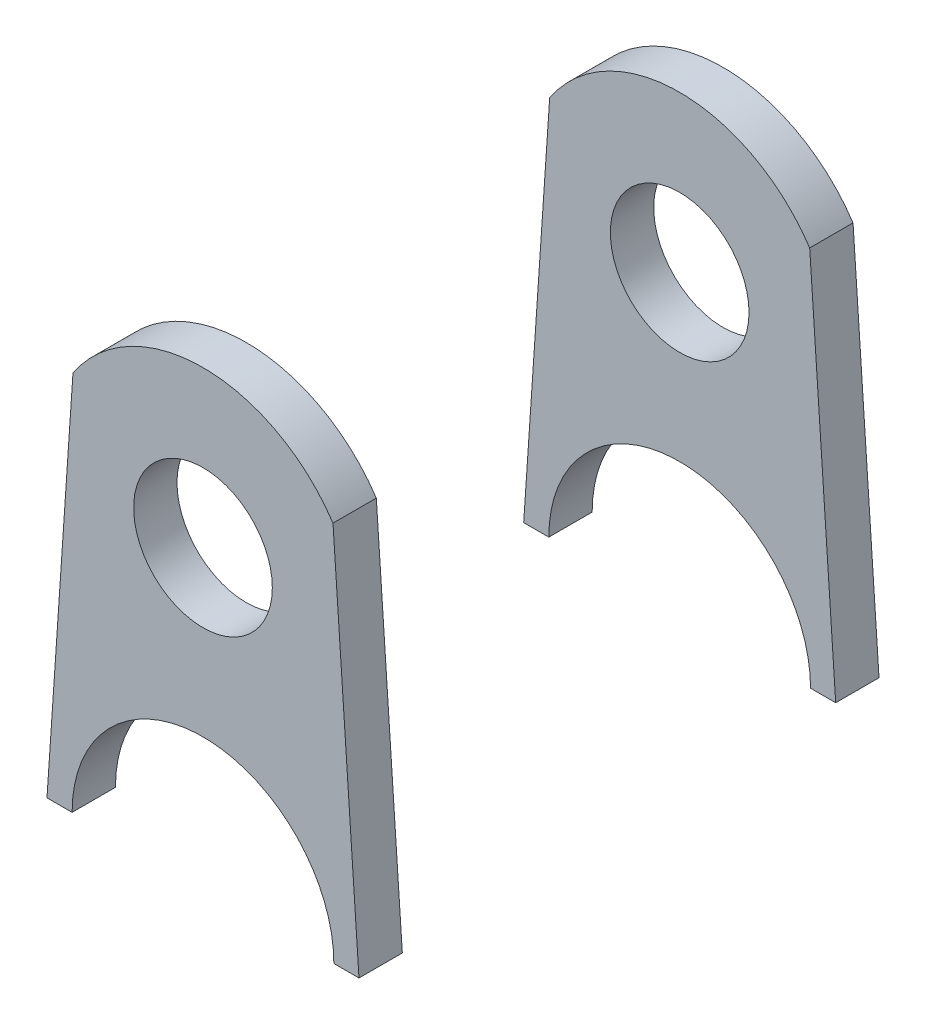
from build123d import *

# Parameters (mm, degrees)
BOSS_EXTRUDE2_DEPTH      = 15
BOSS_EXTRUDE2_DEPTH_BACK = 15
SKETCH1_R                = 7.55
SKETCH1_R_2              = 4
CUT_EXTRUDE4_DEPTH       = 35.252737117
CUT_EXTRUDE4_DEPTH_BACK  = 35.252737117
SKETCH5_W                = 18
SKETCH5_H                = 25
CUT_EXTRUDE5_DEPTH       = 43.991278185
CUT_EXTRUDE5_DEPTH_BACK  = 43.991278185


with BuildPart() as part:
    # Sketch1 → Boss-Extrude2 (new, two sides: drawn at the far end of the back side and taken through both)
    with BuildSketch(Plane.XY.offset(-BOSS_EXTRUDE2_DEPTH_BACK)):
        with BuildLine():
            Line((-1.416520296, 1.222974164), (-1.5, 0))
            ThreePointArc((-1.5, 0), (7.5, -9), (16.5, 0))
            Line((16.5, 0), (16.416520296, 1.222974164))
            Line((16.416520296, 1.222974164), (15, 21.974937186))
            ThreePointArc((15, 21.974937186), (7.5, 26), (0, 21.974937186))
            Line((0, 21.974937186), (-1.416520296, 1.222974164))
        make_face()
        with Locations((7.5, 0)):
            Circle(SKETCH1_R, mode=Mode.SUBTRACT)
        with Locations((7.5, 17)):
            Circle(SKETCH1_R_2, mode=Mode.SUBTRACT)
    extrude(amount=BOSS_EXTRUDE2_DEPTH + BOSS_EXTRUDE2_DEPTH_BACK)

    # Sketch5 → Cut-Extrude4 (cut, two sides: drawn at the far end of the back side and taken through both)
    with BuildSketch(Plane(origin=(0, 0, 0), x_dir=(1, 0, 0), z_dir=(0, 1, 0)).offset(-CUT_EXTRUDE4_DEPTH_BACK)):
        with Locations((7.5, 0)):
            Rectangle(SKETCH5_W, SKETCH5_H)
    extrude(amount=CUT_EXTRUDE4_DEPTH + CUT_EXTRUDE4_DEPTH_BACK, mode=Mode.SUBTRACT)


with BuildPart() as cut_extrude4_piece_1:
    # of the separate pieces the step leaves, piece 1, a body of its own (cut_extrude4_pieces)
    add(part.part.solids().sort_by_distance((0, 21.974937186, -12.5))[0])


with BuildPart() as cut_extrude4_piece_2:
    # of the separate pieces the step leaves, piece 2, a body of its own (cut_extrude4_pieces)
    add(part.part.solids().sort_by_distance((0, 21.974937186, 15))[0])


with BuildPart() as cut_extrude5_tool:
    # Sketch6 → Cut-Extrude5 (new, two sides: drawn at the far end of the back side and taken through both)
    with BuildSketch(Plane.XY.offset(15).offset(-CUT_EXTRUDE5_DEPTH_BACK)):
        Polygon((7.5, 0), (-2.9473198, 0), (-2.9473198, -10.005342246), (19.305939863, -10.005342246), (19.305939863, 0), align=None)
    extrude(amount=CUT_EXTRUDE5_DEPTH + CUT_EXTRUDE5_DEPTH_BACK)


with BuildPart() as cut_extrude4_piece_1_1:
    add(cut_extrude4_piece_1.part)

    # Cut-Extrude5: cut by cut_extrude5_tool
    add(cut_extrude5_tool.part, mode=Mode.SUBTRACT)


with BuildPart() as cut_extrude4_piece_2_1:
    add(cut_extrude4_piece_2.part)

    # Cut-Extrude5: cut by cut_extrude5_tool
    add(cut_extrude5_tool.part, mode=Mode.SUBTRACT)


solid = Compound([cut_extrude4_piece_1_1.part, cut_extrude4_piece_2_1.part])
